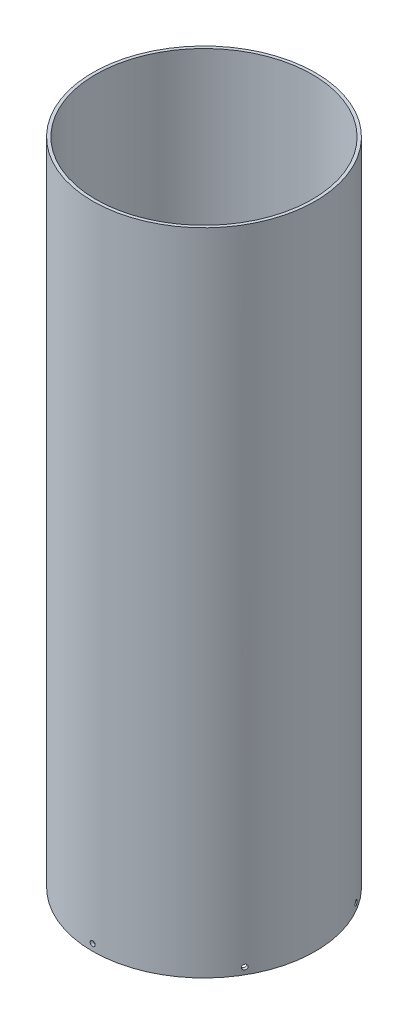
from build123d import *

# Parameters (mm, degrees)
SKETCH1_R           = 78.359
SKETCH1_R_2         = 76.2
BOSS_EXTRUDE1_DEPTH = 457.2
SKETCH2_R           = 1.750000056
CUT_EXTRUDE1_DEPTH  = 471.438206104
CIRPATTERN1_COUNT   = 6


with BuildPart() as part:
    # Sketch1 → Boss-Extrude1 (new body)
    with BuildSketch(Plane(origin=(0, 0, 0), x_dir=(1, 0, 0), z_dir=(0, 1, 0))):
        with Locations(Location((0, 0, 0), (0, 0, 270))):
            Circle(SKETCH1_R)
        with Locations(Location((0, 0, 0), (0, 0, 270))):
            Circle(SKETCH1_R_2, mode=Mode.SUBTRACT)
    extrude(amount=BOSS_EXTRUDE1_DEPTH)

    # Sketch2 → Cut-Extrude1 (cut, through all)
    with BuildSketch(Plane.XY):
        with Locations(Location((0, 4.7625, 0), (0, 0, 90))):
            Circle(SKETCH2_R)
    cut_extrude1 = extrude(amount=-CUT_EXTRUDE1_DEPTH, mode=Mode.SUBTRACT)

    # CirPattern1: Cut-Extrude1 ×6 about axis
    cirpattern1_axis = Axis((0, 457.2, 0), (0, -1, 0))
    for i in range(1, CIRPATTERN1_COUNT):
        add(cut_extrude1.rotate(cirpattern1_axis, i * 360 / CIRPATTERN1_COUNT), mode=Mode.SUBTRACT)


solid = part.part
